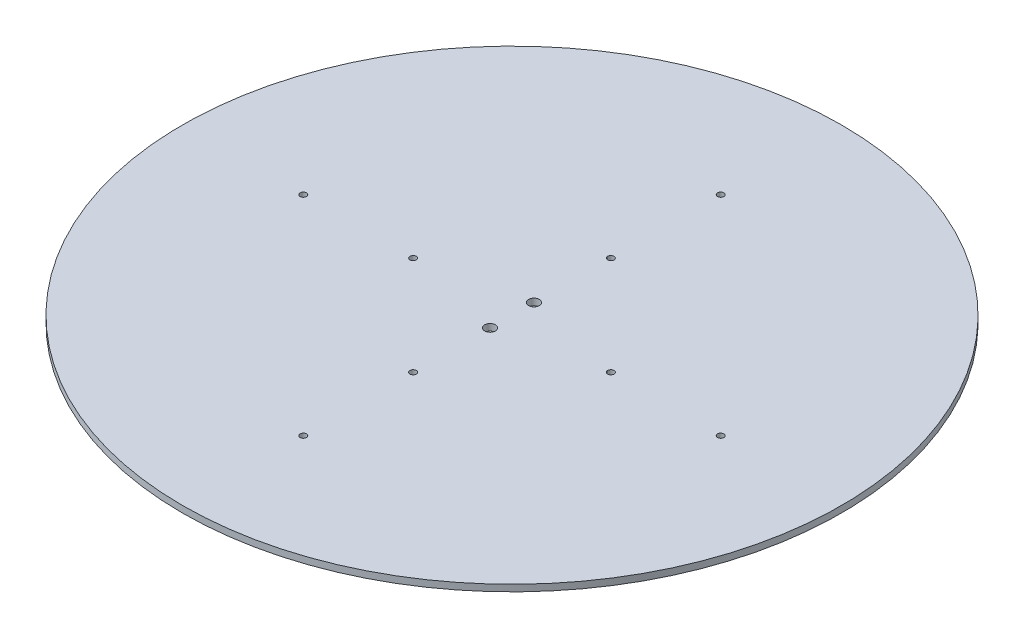
from build123d import *

# Parameters (mm, degrees)
SKETCH1_R           = 150
SKETCH1_R_2         = 2.45
SKETCH1_R_3         = 1.45
BOSS_EXTRUDE1_DEPTH = 3


with BuildPart() as part:
    # Sketch1 → Boss-Extrude1 (new body)
    with BuildSketch(Plane(origin=(0, 0, 0), x_dir=(1, 0, 0), z_dir=(0, 1, 0))):
        with Locations(Location((0, 0, 0), (0, 0, 270))):
            Circle(SKETCH1_R)
        with Locations(Location((0, 10, 0), (0, 0, 270))):
            Circle(SKETCH1_R_2, mode=Mode.SUBTRACT)
        with Locations(Location((0, -10, 0), (0, 0, 270))):
            Circle(SKETCH1_R_2, mode=Mode.SUBTRACT)
        with Locations(Location((45, 0, 0), (0, 0, 270))):
            Circle(SKETCH1_R_3, mode=Mode.SUBTRACT)
        with Locations(Location((95, 0, 0), (0, 0, 270))):
            Circle(SKETCH1_R_3, mode=Mode.SUBTRACT)
        with Locations(Location((0, -45, 0), (0, 0, 270))):
            Circle(SKETCH1_R_3, mode=Mode.SUBTRACT)
        with Locations(Location((0, -95, 0), (0, 0, 270))):
            Circle(SKETCH1_R_3, mode=Mode.SUBTRACT)
        with Locations(Location((-95, 0, 0), (0, 0, 270))):
            Circle(SKETCH1_R_3, mode=Mode.SUBTRACT)
        with Locations(Location((-45, 0, 0), (0, 0, 270))):
            Circle(SKETCH1_R_3, mode=Mode.SUBTRACT)
        with Locations(Location((0, 95, 0), (0, 0, 270))):
            Circle(SKETCH1_R_3, mode=Mode.SUBTRACT)
        with Locations(Location((0, 45, 0), (0, 0, 270))):
            Circle(SKETCH1_R_3, mode=Mode.SUBTRACT)
    extrude(amount=BOSS_EXTRUDE1_DEPTH)


solid = part.part
